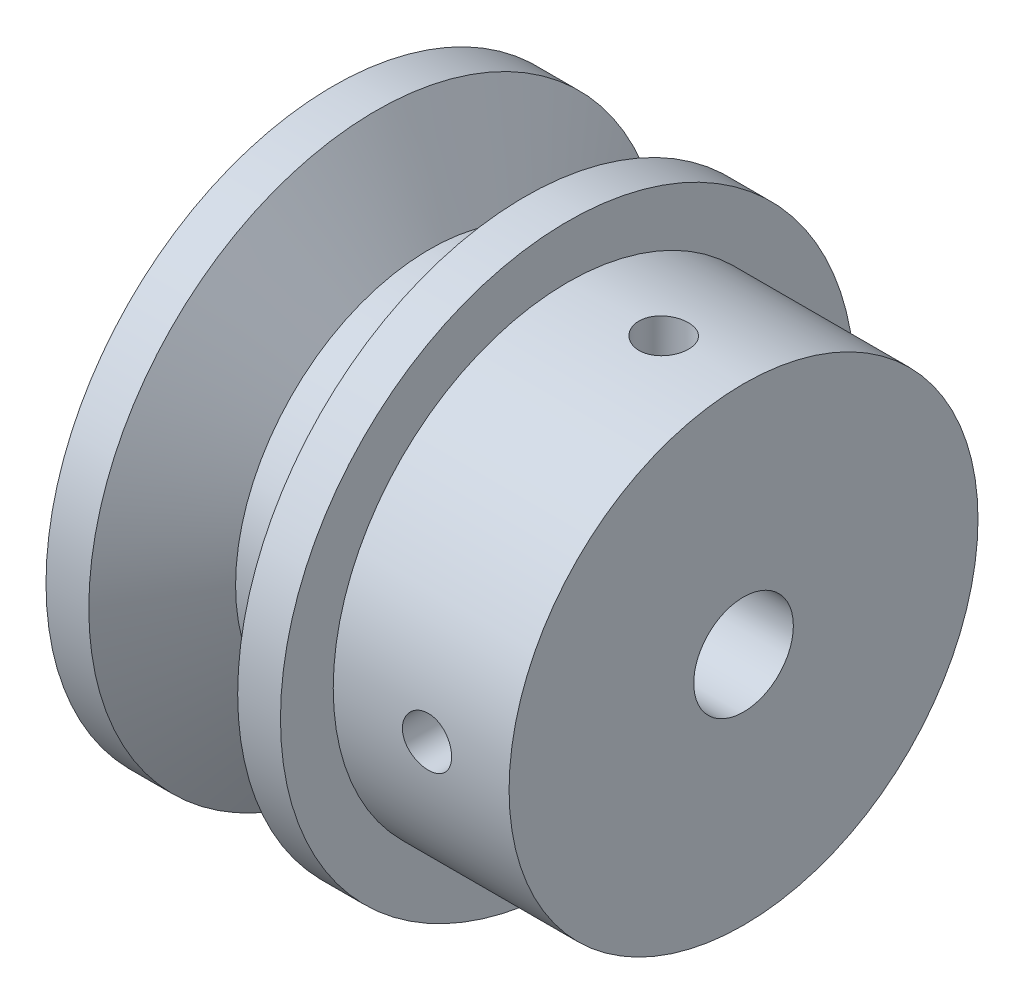
from build123d import *

# Parameters (mm, degrees)
PERFORADOR_PARA_ROSCAR_PARA_MACHO_DE_ROS_D     = 4.2
PERFORADOR_PARA_ROSCAR_PARA_MACHO_DE_ROS_DEPTH = 20
PERFORADOR_PARA_ROSCAR_PARA_MACHO_DE_ROS_TIP   = 1.2618073
PERFORADOR_PARA_ROSCAR_PARA_MACHO_DE_2_D       = 4.2
PERFORADOR_PARA_ROSCAR_PARA_MACHO_DE_2_DEPTH   = 20
PERFORADOR_PARA_ROSCAR_PARA_MACHO_DE_2_TIP     = 1.2618073
PERFORADOR_PARA_ROSCAR_PARA_MACHO_DE_3_D       = 8.5
PERFORADOR_PARA_ROSCAR_PARA_MACHO_DE_3_DEPTH   = 40
PERFORADOR_PARA_ROSCAR_PARA_MACHO_DE_3_TIP     = 2.553657631


with BuildPart() as part:
    # Croquis1 → Revolución1 (revolve)
    with BuildSketch(Plane.XY, mode=Mode.PRIVATE) as revoluci_n1_sk:
        Polygon((16.35, 24.5), (20, 24.5), (20, 20), (35, 20), (35, 0), (0, 0), (0, 24.5), (3.65, 24.5), (8.232717762, 16.5625), (11.767282238, 16.5625), align=None)
    revolve(revoluci_n1_sk.sketch.rotate(Axis((0, 0, 0), (1, 0, 0)), 90), axis=Axis((0, 0, 0), (1, 0, 0)))

    # Perforador para roscar para macho de ros
    with Locations(Plane(origin=(28, 0, 20), x_dir=(1, 0, 0), z_dir=(0, 0, 1))):
        with Locations((0, 0)):
            Hole(PERFORADOR_PARA_ROSCAR_PARA_MACHO_DE_ROS_D / 2, depth=PERFORADOR_PARA_ROSCAR_PARA_MACHO_DE_ROS_DEPTH)
            with Locations((0, 0, -(PERFORADOR_PARA_ROSCAR_PARA_MACHO_DE_ROS_DEPTH + PERFORADOR_PARA_ROSCAR_PARA_MACHO_DE_ROS_TIP / 2))):  # 118° drill point
                Cone(0, PERFORADOR_PARA_ROSCAR_PARA_MACHO_DE_ROS_D / 2, PERFORADOR_PARA_ROSCAR_PARA_MACHO_DE_ROS_TIP, mode=Mode.SUBTRACT)

    # Perforador para roscar para macho de 2
    with Locations(Plane(origin=(28, 19.999069745, -0.192897185), x_dir=(0, 0.009645004686, 0.999953485861), z_dir=(0, 0.999953485861, -0.009645004686))):
        with Locations((0, 0)):
            Hole(PERFORADOR_PARA_ROSCAR_PARA_MACHO_DE_2_D / 2, depth=PERFORADOR_PARA_ROSCAR_PARA_MACHO_DE_2_DEPTH)
            with Locations((0, 0, -(PERFORADOR_PARA_ROSCAR_PARA_MACHO_DE_2_DEPTH + PERFORADOR_PARA_ROSCAR_PARA_MACHO_DE_2_TIP / 2))):  # 118° drill point
                Cone(0, PERFORADOR_PARA_ROSCAR_PARA_MACHO_DE_2_D / 2, PERFORADOR_PARA_ROSCAR_PARA_MACHO_DE_2_TIP, mode=Mode.SUBTRACT)

    # Perforador para roscar para macho de 3
    with Locations(Plane(origin=(35, 0, 0), x_dir=(0, 0, -1), z_dir=(1, 0, 0))):
        with Locations((0, 0)):
            Hole(PERFORADOR_PARA_ROSCAR_PARA_MACHO_DE_3_D / 2, depth=PERFORADOR_PARA_ROSCAR_PARA_MACHO_DE_3_DEPTH)
            with Locations((0, 0, -(PERFORADOR_PARA_ROSCAR_PARA_MACHO_DE_3_DEPTH + PERFORADOR_PARA_ROSCAR_PARA_MACHO_DE_3_TIP / 2))):  # 118° drill point
                Cone(0, PERFORADOR_PARA_ROSCAR_PARA_MACHO_DE_3_D / 2, PERFORADOR_PARA_ROSCAR_PARA_MACHO_DE_3_TIP, mode=Mode.SUBTRACT)


solid = part.part
